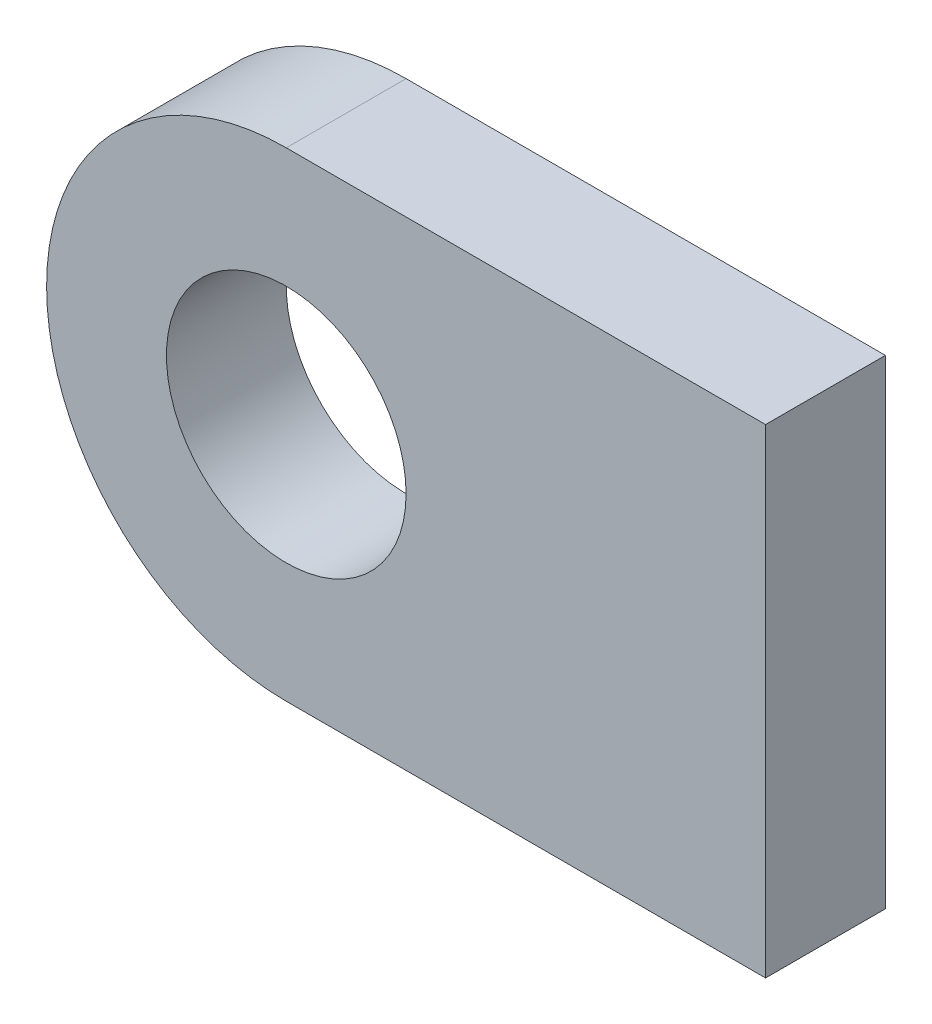
from build123d import *

# Parameters (mm, degrees)
BOSS_EXTRUDE2_DEPTH        = 5
F_10_0MM_DOWEL_HOLE1_D     = 10
F_10_0MM_DOWEL_HOLE1_DEPTH = 10
F_10_0MM_DOWEL_HOLE1_TIP   = 3.004303095


with BuildPart() as part:
    # Sketch4 → Boss-Extrude2 (new body)
    with BuildSketch(Plane.XY):
        with BuildLine():
            Line((-33.548890297, 10), (-13.548890297, 10))
            Line((-13.548890297, 10), (-13.548890297, -10))
            Line((-13.548890297, -10), (-33.548890297, -10))
            ThreePointArc((-33.548890297, -10), (-43.548890297, 0), (-33.548890297, 10))
        make_face()
    extrude(amount=BOSS_EXTRUDE2_DEPTH)

    # Ø10.0mm Dowel Hole1
    with Locations(Plane.XY.offset(5)):
        with Locations((-33.548890297, 0)):
            Hole(F_10_0MM_DOWEL_HOLE1_D / 2, depth=F_10_0MM_DOWEL_HOLE1_DEPTH)
            with Locations((0, 0, -(F_10_0MM_DOWEL_HOLE1_DEPTH + F_10_0MM_DOWEL_HOLE1_TIP / 2))):  # 118° drill point
                Cone(0, F_10_0MM_DOWEL_HOLE1_D / 2, F_10_0MM_DOWEL_HOLE1_TIP, mode=Mode.SUBTRACT)


solid = part.part
